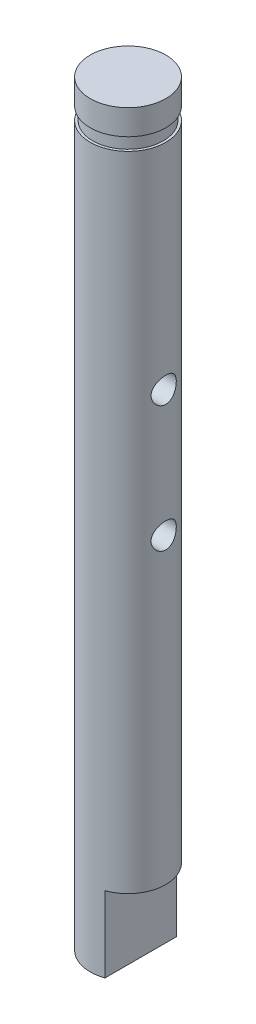
from build123d import *

# Parameters (mm, degrees)
CROQUIS1_R                 = 3
SALIENTE_EXTRUIR1_DEPTH    = 60
CROQUIS2_W                 = 5.531234996
CROQUIS2_H                 = 1
CORTAR_EXTRUIR1_DEPTH      = 61.149812967
CORTAR_EXTRUIR1_DEPTH_BACK = 61.149812967
CROQUIS3_R                 = 1
CORTAR_EXTRUIR2_DEPTH      = 6


with BuildPart() as part:
    # Croquis1 → Saliente-Extruir1 (new body)
    with BuildSketch(Plane(origin=(0, 0, 0), x_dir=(1, 0, 0), z_dir=(0, 1, 0))):
        with Locations(Location((0, 0, 0), (0, 0, 270))):
            Circle(CROQUIS1_R)
    extrude(amount=SALIENTE_EXTRUIR1_DEPTH)

    # Croquis2 → Cortar-Revolución1 (revolve, cut)
    with BuildSketch(Plane.XY, mode=Mode.PRIVATE) as cortar_revoluci_n1_sk:
        with Locations((5.565617498, 57.5)):
            Rectangle(CROQUIS2_W, CROQUIS2_H)
    revolve(cortar_revoluci_n1_sk.sketch.rotate(Axis((0, 60, 0), (0, -1, 0)), 90), axis=Axis((0, 60, 0), (0, -1, 0)), mode=Mode.SUBTRACT)

    # Croquis3 → Cortar-Extruir1 (cut, two sides: drawn at the far end of the back side and taken through both)
    with BuildSketch(Plane(origin=(0, 0, 0), x_dir=(0, 0, -1), z_dir=(1, 0, 0)).offset(-CORTAR_EXTRUIR1_DEPTH_BACK)):
        with Locations((0, 40)):
            Circle(CROQUIS3_R)
        with Locations((0, 30)):
            Circle(CROQUIS3_R)
    extrude(amount=CORTAR_EXTRUIR1_DEPTH + CORTAR_EXTRUIR1_DEPTH_BACK, mode=Mode.SUBTRACT)

    # Croquis4 → Cortar-Extruir2 (cut)
    with BuildSketch(Plane.XZ):
        with BuildLine():
            Line((1, 2.828427125), (1, -2.828427125))
            ThreePointArc((1, -2.828427125), (3, 0), (1, 2.828427125))
        make_face()
    extrude(amount=-CORTAR_EXTRUIR2_DEPTH, mode=Mode.SUBTRACT)


solid = part.part
